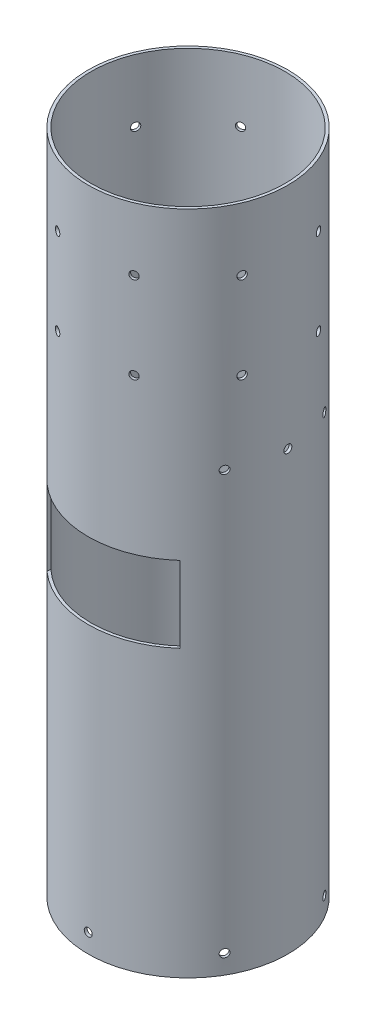
from build123d import *

# Parameters (mm, degrees)
SKETCH_1_W               = 1.5
SKETCH_1_H               = 350
SKETCH_2_R               = 2.1
CUT_EXTRUDE_2_DEPTH      = 88
PATTERN_CIRCULAR_2_COUNT = 6
SKETCH_8_R               = 2.1
CUT_EXTRUDE_3_DEPTH      = 32
PATTERN_CIRCULAR_3_COUNT = 8
SKETCH_9_R               = 2.1
CUT_EXTRUDE_4_DEPTH      = 171
PATTERN_CIRCULAR_4_COUNT = 2
PATTERN_CIRCULAR_4_ANGLE = 30
F_4_THE_OTHER_WAY_COUNT  = 2
F_4_THE_OTHER_WAY_ANGLE  = 30
SKETCH_10_W              = 70
SKETCH_10_H              = 40
CUT_EXTRUDE_5_DEPTH      = 358.788345386


with BuildPart() as part:
    # Эскиз1 → Повернуть1 (revolve)
    with BuildSketch(Plane.XY, mode=Mode.PRIVATE) as revolve_1_sk:
        with Locations((51.75, 175)):
            Rectangle(SKETCH_1_W, SKETCH_1_H)
    revolve(revolve_1_sk.sketch.rotate(Axis((0, 0, 0), (0, 1, 0)), 90), axis=Axis((0, 0, 0), (0, 1, 0)))

    # Эскиз2 → Вырез-Вытянуть2 (cut)
    with BuildSketch(Plane.XY):
        with Locations(Location((0, 10, 0), (0, 0, 90))):
            Circle(SKETCH_2_R)
    cut_extrude_2 = extrude(amount=-CUT_EXTRUDE_2_DEPTH, mode=Mode.SUBTRACT)

    # Круговой массив2: Вырез-Вытянуть2 ×6 about axis
    pattern_circular_2_axis = Axis((0, 0, 0), (0, -1, 0))
    for i in range(1, PATTERN_CIRCULAR_2_COUNT):
        add(cut_extrude_2.rotate(pattern_circular_2_axis, i * 360 / PATTERN_CIRCULAR_2_COUNT), mode=Mode.SUBTRACT)

    # Эскиз8 → Вырез-Вытянуть3 (cut)
    with BuildSketch(Plane(origin=(18.03122292, 0, 43.53122292), x_dir=(0.9238795325112864, 0, -0.3826834323650906), z_dir=(0.3826834323650906, 0, 0.9238795325112864))):
        with Locations(Location((0, 317, 0), (0, 0, 180))):
            Circle(SKETCH_8_R)
        with Locations(Location((0, 271.5, 0), (0, 0, 180))):
            Circle(SKETCH_8_R)
    cut_extrude_3 = extrude(amount=CUT_EXTRUDE_3_DEPTH, mode=Mode.SUBTRACT)

    # Круговой массив3: Вырез-Вытянуть3 ×8 about axis
    pattern_circular_3_axis = Axis((0, 0, 0), (0, -1, 0))
    for i in range(1, PATTERN_CIRCULAR_3_COUNT):
        add(cut_extrude_3.rotate(pattern_circular_3_axis, i * 360 / PATTERN_CIRCULAR_3_COUNT), mode=Mode.SUBTRACT)

    # Эскиз9 → Вырез-Вытянуть4 (cut)
    with BuildSketch(Plane(origin=(0, 0, 0), x_dir=(0, 0, -1), z_dir=(1, 0, 0))):
        with Locations(Location((0, 230, 0), (0, 0, 180))):
            Circle(SKETCH_9_R)
    cut_extrude_4 = extrude(amount=CUT_EXTRUDE_4_DEPTH, mode=Mode.SUBTRACT)

    # Круговой массив4: Вырез-Вытянуть4 ×2 about axis
    pattern_circular_4_axis = Axis((0, 0, 0), (0, -1, 0))
    for i in range(1, PATTERN_CIRCULAR_4_COUNT):
        add(cut_extrude_4.rotate(pattern_circular_4_axis, i * PATTERN_CIRCULAR_4_ANGLE / (PATTERN_CIRCULAR_4_COUNT - 1)), mode=Mode.SUBTRACT)

    # 4 the other way: Вырез-Вытянуть4 ×2 about axis
    f_4_the_other_way_axis = Axis((0, 0, 0), (0, 1, 0))
    for i in range(1, F_4_THE_OTHER_WAY_COUNT):
        add(cut_extrude_4.rotate(f_4_the_other_way_axis, i * F_4_THE_OTHER_WAY_ANGLE / (F_4_THE_OTHER_WAY_COUNT - 1)), mode=Mode.SUBTRACT)

    # Эскиз10 → Вырез-Вытянуть5 (cut, through all)
    with BuildSketch(Plane.XY):
        with Locations((0, 170)):
            Rectangle(SKETCH_10_W, SKETCH_10_H)
    extrude(amount=CUT_EXTRUDE_5_DEPTH, mode=Mode.SUBTRACT)


solid = part.part
